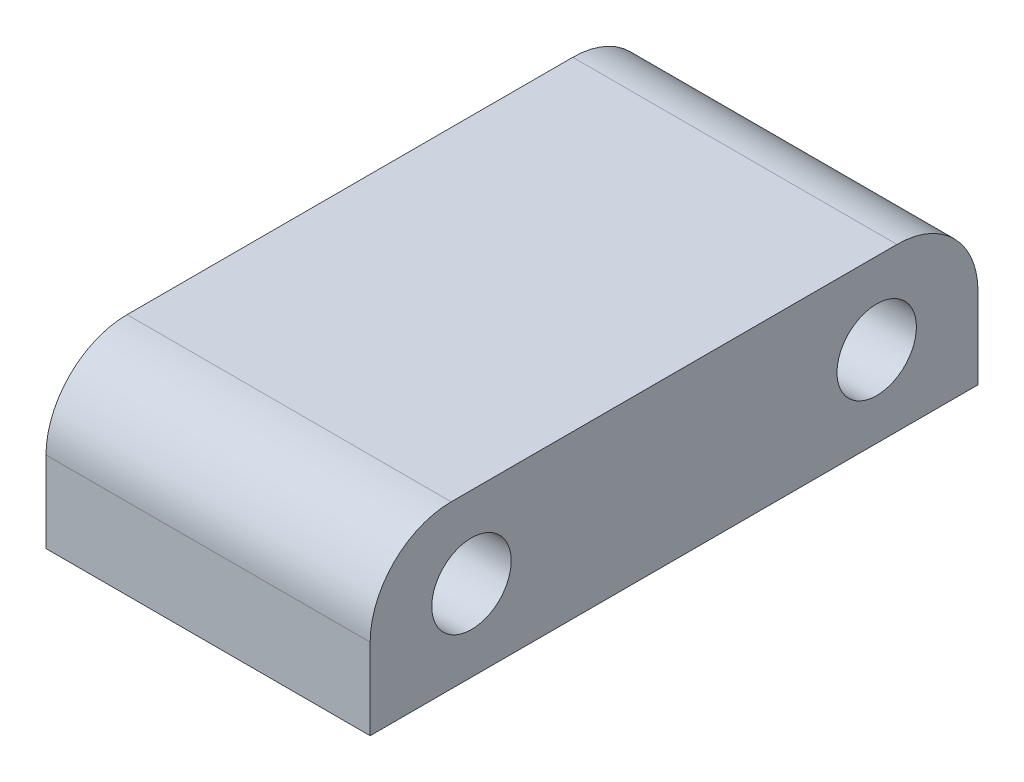
from build123d import *

# Parameters (mm, degrees)
SKETCH1_W           = 75
SKETCH1_H           = 20
SKETCH1_R           = 4.9
BOSS_EXTRUDE1_DEPTH = 20
FILLET1_R           = 10


with BuildPart() as part:
    # Sketch1 → Boss-Extrude1 (new, symmetric)
    with BuildSketch(Plane(origin=(0, 0, 0), x_dir=(0, 0, -1), z_dir=(1, 0, 0))):
        Rectangle(SKETCH1_W, SKETCH1_H)
        with Locations((-25, 0)):
            Circle(SKETCH1_R, mode=Mode.SUBTRACT)
        with Locations((25, 0)):
            Circle(SKETCH1_R, mode=Mode.SUBTRACT)
    extrude(amount=BOSS_EXTRUDE1_DEPTH, both=True)

    # Fillet1
    fillet1_edges = [part.edges().sort_by_distance(p)[0] for p in [
        (0, 10, 37.5),
        (0, 10, -37.5),
    ]]
    fillet(fillet1_edges, radius=FILLET1_R)


solid = part.part
